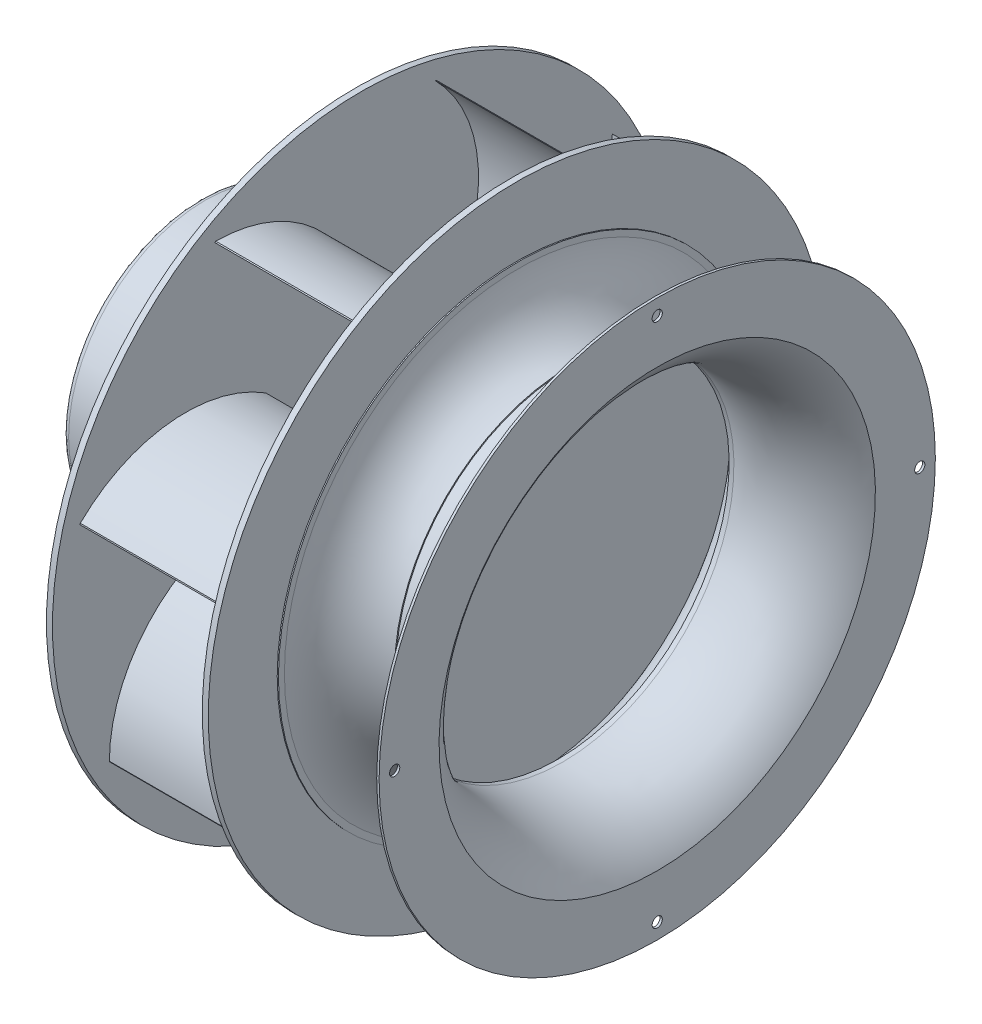
from build123d import *

# Parameters (mm, degrees)
SKETCH2_R         = 257.5
EXTRUDE1_DEPTH    = 5
SKETCH9_R         = 252.5
SKETCH9_R_2       = 100
EXTRUDE7_DEPTH    = 3
SKETCH3_R         = 257.5
EXTRUDE2_DEPTH    = 5
EXTRUDE3_DEPTH    = 130
CIRPATTERN1_COUNT = 8
SKETCH7_R         = 4.25
EXTRUDE5_DEPTH    = 5
CIRPATTERN2_COUNT = 4
SKETCH8_R         = 5
EXTRUDE6_DEPTH    = 90
CIRPATTERN3_COUNT = 8


with BuildPart() as part:
    # Sketch1 → Revolve1 (revolve)
    with BuildSketch(Plane.XY, mode=Mode.PRIVATE) as revolve1_sk:
        with BuildLine():
            Line((0, 0), (0, 109))
            ThreePointArc((0, 109), (1.464466094, 112.535533906), (5, 114))
            Line((5, 114), (70, 114))
            Line((70, 114), (70, 138))
            Line((70, 138), (90, 138))
            Line((90, 138), (90, 98))
            Line((90, 98), (95, 98))
            Line((95, 98), (95, 133))
            Line((95, 133), (105, 133))
            Line((105, 133), (105, 98))
            Line((105, 98), (130, 98))
            Line((130, 98), (130, 0))
            Line((130, 0), (0, 0))
        make_face()
    revolve(revolve1_sk.sketch.rotate(Axis((0, 0, 0), (1, 0, 0)), 90), axis=Axis((0, 0, 0), (1, 0, 0)))

    # Sketch2 → Extrude1 (add)
    with BuildSketch(Plane(origin=(130, 0, 0), x_dir=(0, 0, -1), z_dir=(1, 0, 0))):
        Circle(SKETCH2_R)
    extrude(amount=EXTRUDE1_DEPTH)

    # Sketch9 → Extrude7 (cut)
    with BuildSketch(Plane.ZY.offset(-130)):
        Circle(SKETCH9_R)
        Circle(SKETCH9_R_2, mode=Mode.SUBTRACT)
    extrude(amount=-EXTRUDE7_DEPTH, mode=Mode.SUBTRACT)



with BuildPart() as body_2:
    # Sketch3 → Extrude2 (new body)
    with BuildSketch(Plane(origin=(260, 0, 0), x_dir=(0, 0, -1), z_dir=(1, 0, 0))):
        Circle(SKETCH3_R)
    extrude(amount=EXTRUDE2_DEPTH)


with BuildPart() as part_1:
    add(part.part)

    add(body_2.part)  # Extrude3 merges body 2
    # Sketch4 → Extrude3 (add)
    with BuildSketch(Plane(origin=(135, 0, 0), x_dir=(0, 0, -1), z_dir=(1, 0, 0))):
        with BuildLine():
            Line((-121.25, 210.011160418), (-122.116025404, 209.511160418))
            ThreePointArc((-122.116025404, 209.511160418), (-44.469436379, 181.921031018), (-0.866025404, 112))
            Line((-0.866025404, 112), (0, 112.5))
            ThreePointArc((0, 112.5), (-43.603410976, 182.421031018), (-121.25, 210.011160418))
        make_face()
    extrude3 = extrude(amount=EXTRUDE3_DEPTH)

    # CirPattern1: Extrude3 ×8 about axis
    cirpattern1_axis = Axis((0, 0, 0), (1, 0, 0))
    for i in range(1, CIRPATTERN1_COUNT):
        add(extrude3.rotate(cirpattern1_axis, i * 360 / CIRPATTERN1_COUNT))

    # Sketch5 → Revolve2 (revolve)
    with BuildSketch(Plane.XY, mode=Mode.PRIVATE) as revolve2_sk:
        with BuildLine():
            Line((265, 200), (266, 200))
            Line((266, 200), (266, 195))
            ThreePointArc((266, 195), (280.264553623, 164.150526649), (309, 146))
            Line((309, 146), (309, 145))
            ThreePointArc((309, 145), (279.425239697, 163.334210933), (265, 195))
            Line((265, 195), (265, 200))
        make_face()
    revolve(revolve2_sk.sketch.rotate(Axis((0, 0, 0), (1, 0, 0)), 90), axis=Axis((0, 0, 0), (1, 0, 0)))

    # Sketch8 → Extrude6 (cut)
    with BuildSketch(Plane(origin=(0, 0, 0), x_dir=(0, 0, -1), z_dir=(1, 0, 0))):
        with Locations(Location((0, 126, 0), (0, 0, 180))):
            Circle(SKETCH8_R)
    extrude6 = extrude(amount=EXTRUDE6_DEPTH, mode=Mode.SUBTRACT)

    # CirPattern3: Extrude6 ×8 about axis
    cirpattern3_axis = Axis((0, 0, 0), (1, 0, 0))
    for i in range(1, CIRPATTERN3_COUNT):
        add(extrude6.rotate(cirpattern3_axis, i * 360 / CIRPATTERN3_COUNT), mode=Mode.SUBTRACT)


with BuildPart() as body_2_2:
    # Sketch6 → Revolve3 (revolve)
    with BuildSketch(Plane.XY, mode=Mode.PRIVATE) as revolve3_sk:
        with BuildLine():
            Line((382, 232), (380, 232))
            Line((380, 232), (380, 182))
            ThreePointArc((380, 182), (346.85220133, 152.361635071), (303, 145))
            Line((303, 145), (299, 145))
            Line((299, 145), (299, 143))
            Line((299, 143), (303, 143))
            ThreePointArc((303, 143), (348.352293074, 150.645355054), (382, 182))
            Line((382, 182), (382, 232))
        make_face()
    revolve(revolve3_sk.sketch.rotate(Axis((0, 0, 0), (1, 0, 0)), 180), axis=Axis((0, 0, 0), (1, 0, 0)))

    # Sketch7 → Extrude5 (cut)
    with BuildSketch(Plane(origin=(382, 0, 0), x_dir=(0, 0, -1), z_dir=(1, 0, 0))):
        with Locations((0, 219)):
            Circle(SKETCH7_R)
    extrude5 = extrude(amount=-EXTRUDE5_DEPTH, mode=Mode.SUBTRACT)

    # CirPattern2: Extrude5 ×4 about axis
    cirpattern2_axis = Axis((0, 0, 0), (1, 0, 0))
    for i in range(1, CIRPATTERN2_COUNT):
        add(extrude5.rotate(cirpattern2_axis, i * 360 / CIRPATTERN2_COUNT), mode=Mode.SUBTRACT)


solid = Compound([part_1.part, body_2_2.part])
